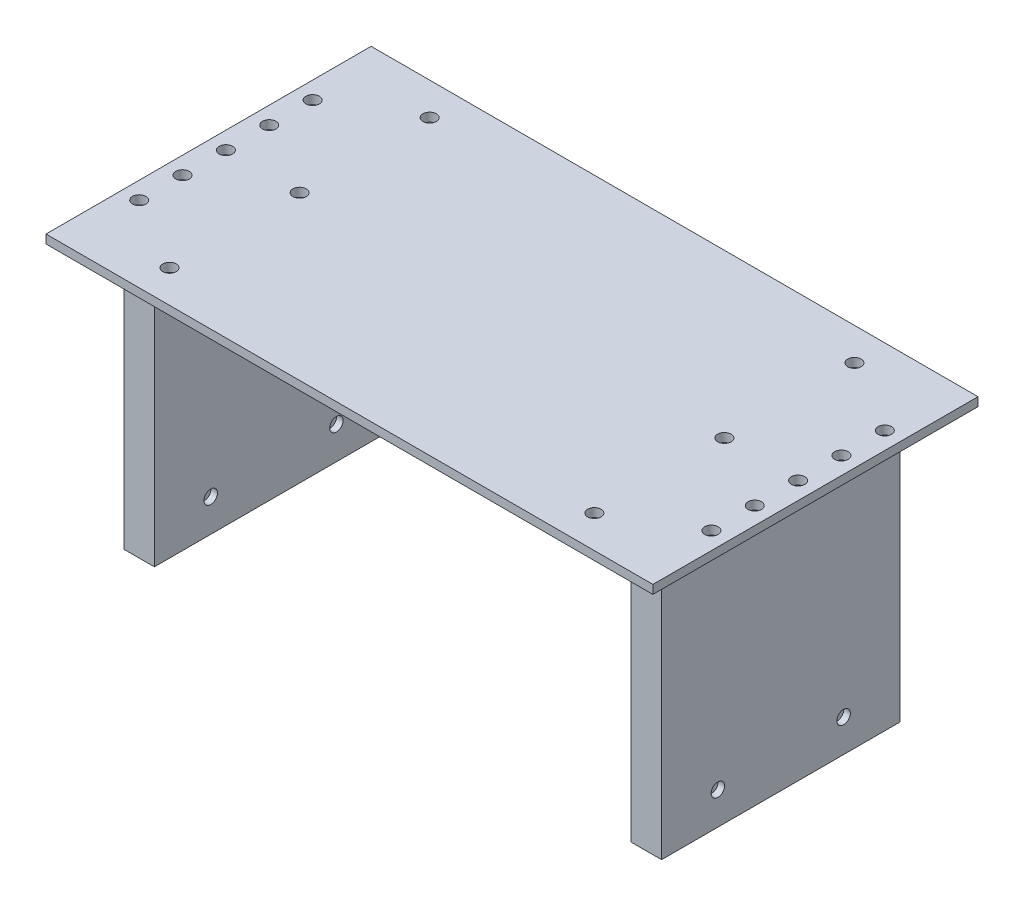
from build123d import *

# Parameters (mm, degrees)
SKETCH_1_W          = 140
SKETCH_1_H          = 75
EXTRUDE_1_DEPTH     = 2
SKETCH_2_R          = 1.55
CUT_EXTRUDE_1_DEPTH = 3
SKETCH_3_W          = 7
SKETCH_3_H          = 55
EXTRUDE_2_DEPTH     = 62
SKETCH_5_R          = 1.55
CUT_EXTRUDE_2_DEPTH = 15
SKETCH_6_R          = 1.55
CUT_EXTRUDE_3_DEPTH = 15
SKETCH_7_W          = 4
SKETCH_7_H          = 52
CUT_EXTRUDE_4_DEPTH = 20


with BuildPart() as part:
    # 草图1 → 凸台-拉伸1 (new body)
    with BuildSketch(Plane(origin=(0, 0, 0), x_dir=(1, 0, 0), z_dir=(0, 1, 0))):
        Rectangle(SKETCH_1_W, SKETCH_1_H)
    extrude(amount=EXTRUDE_1_DEPTH)

    # 草图2 → 切除-拉伸1 (cut)
    with BuildSketch(Plane.XZ):
        with Locations(Location((-49, 0, 0), (0, 0, 270))):
            Circle(SKETCH_2_R)
        with Locations(Location((-49, -30, 0), (0, 0, 270))):
            Circle(SKETCH_2_R)
        with Locations(Location((-49, 30, 0), (0, 0, 270))):
            Circle(SKETCH_2_R)
        with Locations(Location((49, 30, 0), (0, 0, 270))):
            Circle(SKETCH_2_R)
        with Locations(Location((49, 0, 0), (0, 0, 270))):
            Circle(SKETCH_2_R)
        with Locations(Location((49, -30, 0), (0, 0, 270))):
            Circle(SKETCH_2_R)
    extrude(amount=-CUT_EXTRUDE_1_DEPTH, mode=Mode.SUBTRACT)

    # 草图3 → 凸台-拉伸2 (add)
    with BuildSketch(Plane.XZ):
        with Locations((-58.5, 0)):
            Rectangle(SKETCH_3_W, SKETCH_3_H)
        with Locations((58.5, 0)):
            Rectangle(SKETCH_3_W, SKETCH_3_H)
    extrude(amount=EXTRUDE_2_DEPTH)

    # 草图5 → 切除-拉伸2 (cut)
    with BuildSketch(Plane.XZ):
        with Locations(Location((-66, 20, 0), (0, 0, 270))):
            Circle(SKETCH_5_R)
        with Locations(Location((-66, 10, 0), (0, 0, 270))):
            Circle(SKETCH_5_R)
        with Locations(Location((-66, 0, 0), (0, 0, 270))):
            Circle(SKETCH_5_R)
        with Locations(Location((-66, -10, 0), (0, 0, 270))):
            Circle(SKETCH_5_R)
        with Locations(Location((-66, -20, 0), (0, 0, 270))):
            Circle(SKETCH_5_R)
        with Locations(Location((66, -20, 0), (0, 0, 270))):
            Circle(SKETCH_5_R)
        with Locations(Location((66, -10, 0), (0, 0, 270))):
            Circle(SKETCH_5_R)
        with Locations(Location((66, 0, 0), (0, 0, 270))):
            Circle(SKETCH_5_R)
        with Locations(Location((66, 10, 0), (0, 0, 270))):
            Circle(SKETCH_5_R)
        with Locations(Location((66, 20, 0), (0, 0, 270))):
            Circle(SKETCH_5_R)
    extrude(amount=-CUT_EXTRUDE_2_DEPTH, mode=Mode.SUBTRACT)

    # 草图6 → 切除-拉伸3 (cut)
    with BuildSketch(Plane.ZY.offset(62)):
        with Locations((-14.5, -54.5)):
            Circle(SKETCH_6_R)
        with Locations((14.5, -54.5)):
            Circle(SKETCH_6_R)
    cut_extrude_3 = extrude(amount=-CUT_EXTRUDE_3_DEPTH, mode=Mode.SUBTRACT)

    # 镜向1: 切除-拉伸3 across plane
    add(cut_extrude_3.mirror(Plane(origin=(0, 0, 0), x_dir=(0, 0, 1), z_dir=(1, 0, 0))), mode=Mode.SUBTRACT)

    # 草图7 → 切除-拉伸4 (cut)
    with BuildSketch(Plane.XZ.offset(62)):
        with Locations((58.5, 0)):
            Rectangle(SKETCH_7_W, SKETCH_7_H)
        with Locations((-58.5, 0)):
            Rectangle(SKETCH_7_W, SKETCH_7_H)
    extrude(amount=-CUT_EXTRUDE_4_DEPTH, mode=Mode.SUBTRACT)


solid = part.part
